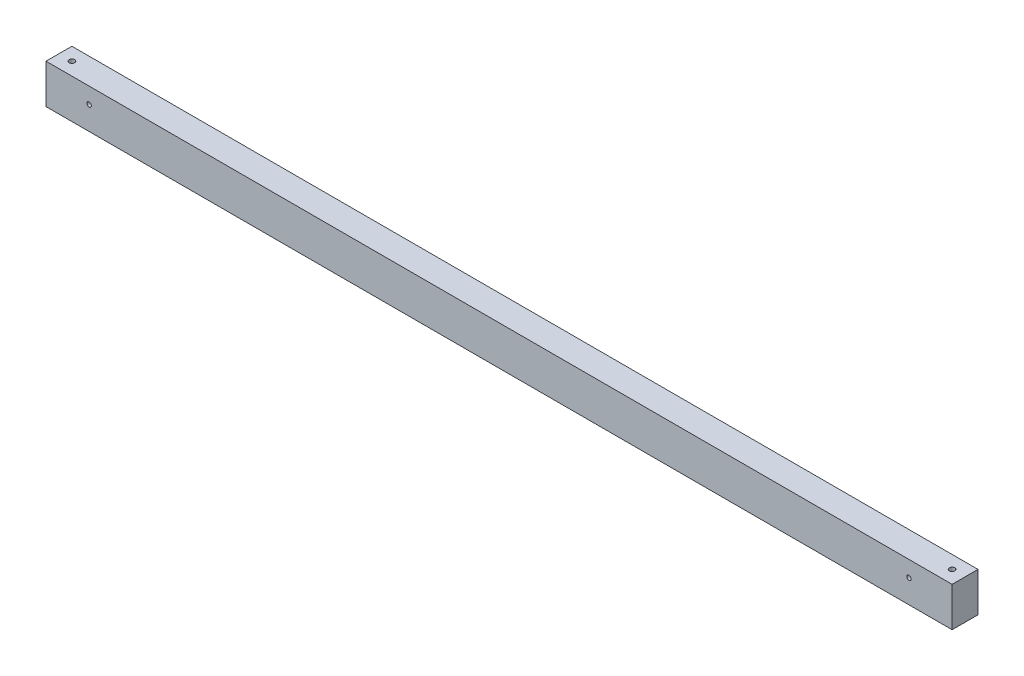
from build123d import *

# Parameters (mm, degrees)
SKETCH1_W           = 2100
SKETCH1_H           = 60
BOSS_EXTRUDE1_DEPTH = 91.2
SKETCH2_R           = 5.1
CUT_EXTRUDE1_DEPTH  = 1056.659717902
CUT_EXTRUDE2_START  = 91.2
SKETCH3_R           = 6.35
CUT_EXTRUDE2_DEPTH  = 91.2


with BuildPart() as part:
    # Sketch1 → Boss-Extrude1 (new body)
    with BuildSketch(Plane(origin=(0, 0, 0), x_dir=(1, 0, 0), z_dir=(0, 1, 0))):
        with Locations((0, 30)):
            Rectangle(SKETCH1_W, SKETCH1_H)
    extrude(amount=BOSS_EXTRUDE1_DEPTH)

    # Sketch2 → Cut-Extrude1 (cut, through all)
    with BuildSketch(Plane.XY):
        with Locations(Location((-950, 54.25, 0), (0, 0, 180))):
            Circle(SKETCH2_R)
        with Locations(Location((950, 54.25, 0), (0, 0, 180))):
            Circle(SKETCH2_R)
    extrude(amount=-CUT_EXTRUDE1_DEPTH, mode=Mode.SUBTRACT)

    # Sketch3 → Cut-Extrude2 (cut)
    with BuildSketch(Plane(origin=(0, 0, 0), x_dir=(1, 0, 0), z_dir=(0, 1, 0)).offset(CUT_EXTRUDE2_START)):
        with Locations(Location((1020, 30, 0), (0, 0, 270))):
            Circle(SKETCH3_R)
        with Locations(Location((-1020, 30, 0), (0, 0, 270))):
            Circle(SKETCH3_R)
    extrude(amount=-CUT_EXTRUDE2_DEPTH, mode=Mode.SUBTRACT)


solid = part.part
